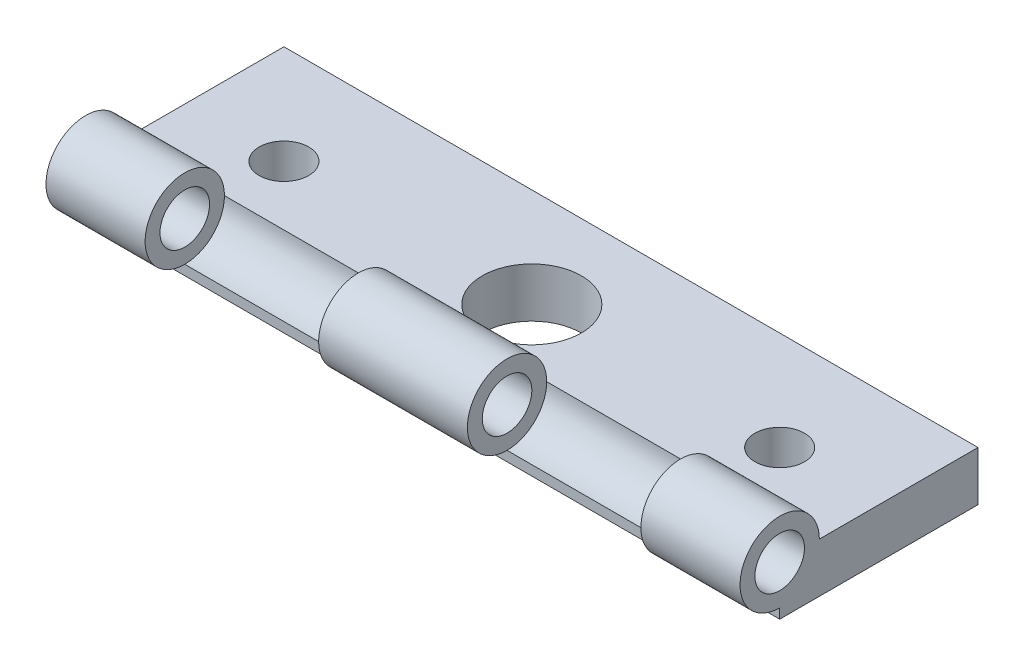
from build123d import *

# Parameters (mm, degrees)
SKETCH2_W           = 88.9
SKETCH2_H           = 25.4
SKETCH2_R           = 3.175
SKETCH2_R_2         = 6.35
BOSS_EXTRUDE1_DEPTH = 6.35
SKETCH3_R           = 5.08
CUT_EXTRUDE1_DEPTH  = 93.675198948
SKETCH4_R           = 5.08
SKETCH4_R_2         = 3.175
BOSS_EXTRUDE2_DEPTH = 12.7
SKETCH5_R           = 5.08
SKETCH5_R_2         = 3.175
BOSS_EXTRUDE3_DEPTH = 9.525


with BuildPart() as part:
    # Sketch2 → Boss-Extrude1 (new body)
    with BuildSketch(Plane(origin=(0, 0, 0), x_dir=(1, 0, 0), z_dir=(0, 1, 0))):
        with Locations((0, 12.7)):
            Rectangle(SKETCH2_W, SKETCH2_H)
        with Locations(Location((-31.75, 12.7, 0), (0, 0, 270))):
            Circle(SKETCH2_R, mode=Mode.SUBTRACT)
        with Locations(Location((0, 12.7, 0), (0, 0, 270))):
            Circle(SKETCH2_R_2, mode=Mode.SUBTRACT)
        with Locations(Location((31.75, 12.7, 0), (0, 0, 270))):
            Circle(SKETCH2_R, mode=Mode.SUBTRACT)
    extrude(amount=BOSS_EXTRUDE1_DEPTH)

    # Sketch3 → Cut-Extrude1 (cut, through all)
    with BuildSketch(Plane.ZY.offset(44.45)):
        with Locations((0, 6.35)):
            Circle(SKETCH3_R)
    extrude(amount=-CUT_EXTRUDE1_DEPTH, mode=Mode.SUBTRACT)

    # Sketch4 → Boss-Extrude2 (add)
    with BuildSketch(Plane.ZY.offset(44.45)):
        with Locations((0, 6.35)):
            Circle(SKETCH4_R)
        with Locations((0, 6.35)):
            Circle(SKETCH4_R_2, mode=Mode.SUBTRACT)
    boss_extrude2 = extrude(amount=-BOSS_EXTRUDE2_DEPTH)

    # Mirror1: Boss-Extrude2 across plane
    add(boss_extrude2.mirror(Plane(origin=(0, 0, 0), x_dir=(0, 0, 1), z_dir=(1, 0, 0))))

    # Sketch5 → Boss-Extrude3 (add, symmetric)
    with BuildSketch(Plane(origin=(0, 0, 0), x_dir=(0, 0, -1), z_dir=(1, 0, 0))):
        with Locations((0, 6.35)):
            Circle(SKETCH5_R)
        with Locations(Location((0, 6.35, 0), (0, 0, 180))):
            Circle(SKETCH5_R_2, mode=Mode.SUBTRACT)
    extrude(amount=BOSS_EXTRUDE3_DEPTH, both=True)


solid = part.part
